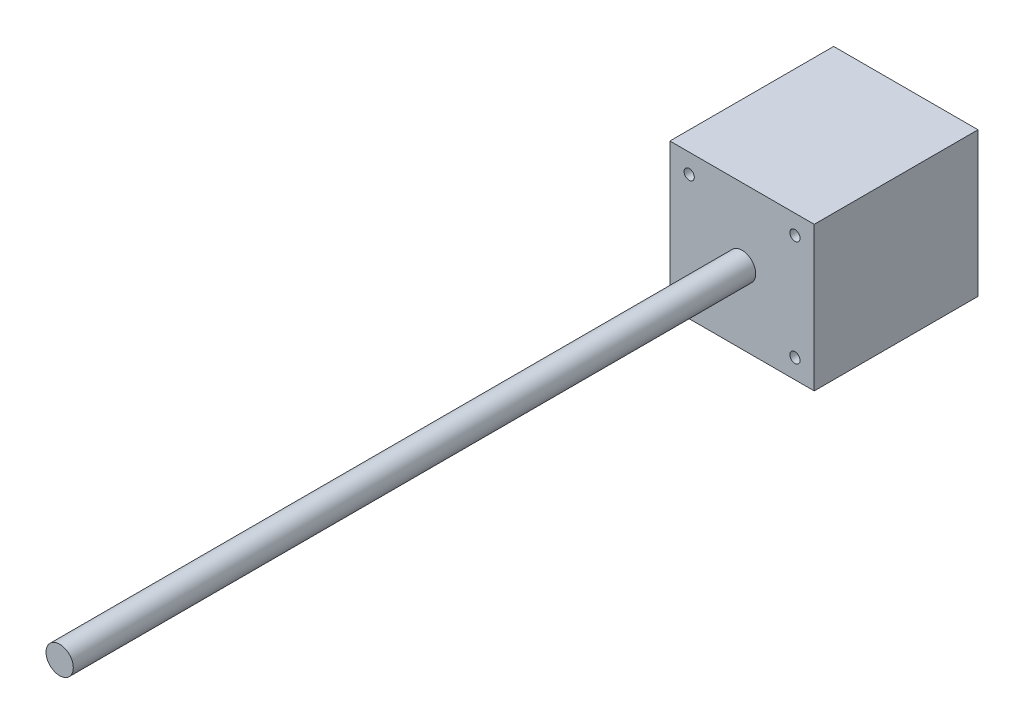
from build123d import *

# Parameters (mm, degrees)
SKETCH1_W           = 42.3
SKETCH1_H           = 42.3
SKETCH1_R           = 1.5
BOSS_EXTRUDE1_DEPTH = 48
SKETCH2_R           = 4
BOSS_EXTRUDE2_DEPTH = 200


with BuildPart() as part:
    # Sketch1 → Boss-Extrude1 (new body)
    with BuildSketch(Plane.XY):
        Rectangle(SKETCH1_W, SKETCH1_H)
        with Locations((15.5, 15.5)):
            Circle(SKETCH1_R, mode=Mode.SUBTRACT)
        with Locations((-15.5, 15.5)):
            Circle(SKETCH1_R, mode=Mode.SUBTRACT)
        with Locations((-15.5, -15.5)):
            Circle(SKETCH1_R, mode=Mode.SUBTRACT)
        with Locations((15.5, -15.5)):
            Circle(SKETCH1_R, mode=Mode.SUBTRACT)
    extrude(amount=BOSS_EXTRUDE1_DEPTH)

    # Sketch2 → Boss-Extrude2 (add)
    with BuildSketch(Plane.XY.offset(48)):
        with Locations(Location((0, 0, 0), (0, 0, 180))):
            Circle(SKETCH2_R)
    extrude(amount=BOSS_EXTRUDE2_DEPTH)


solid = part.part
